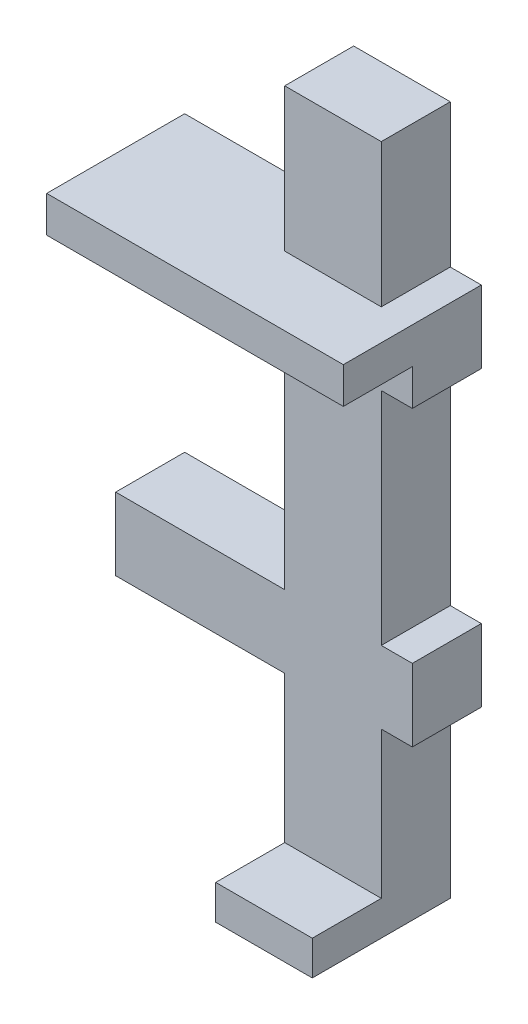
from build123d import *

# Parameters (mm, degrees)
SKETCH1_W               = 5.6
SKETCH1_H               = 40
BOSS_EXTRUDE1_DEPTH     = 4
SKETCH2_W               = 5.6
SKETCH2_H               = 2
BOSS_EXTRUDE2_DEPTH     = 4
SKETCH4_W               = 4
SKETCH4_H               = 4.2
BOSS_EXTRUDE3_DEPTH     = 1.8
MIRROR2_COPY_1_SKETCH_W = 4
MIRROR2_COPY_1_SKETCH_H = 4.2
MIRROR2_COPY_1_DEPTH    = 1.8
SKETCH8_W               = 4
SKETCH8_H               = 4.2
BOSS_EXTRUDE4_DEPTH     = 8
SKETCH9_W               = 17.2
SKETCH9_H               = 2.1
BOSS_EXTRUDE5_DEPTH     = 4


with BuildPart() as part:
    # Sketch1 → Boss-Extrude1 (new body)
    with BuildSketch(Plane.XY):
        Rectangle(SKETCH1_W, SKETCH1_H)
    extrude(amount=BOSS_EXTRUDE1_DEPTH)

    # Sketch2 → Boss-Extrude2 (add)
    with BuildSketch(Plane.XY.offset(4)):
        with Locations((0, -19)):
            Rectangle(SKETCH2_W, SKETCH2_H)
    extrude(amount=BOSS_EXTRUDE2_DEPTH)

    # Sketch4 → Boss-Extrude3 (add)
    with BuildSketch(Plane.ZY.offset(2.8)):
        with Locations((2, 9.6)):
            Rectangle(SKETCH4_W, SKETCH4_H)
    boss_extrude3 = extrude(amount=BOSS_EXTRUDE3_DEPTH)

    # Mirror1: Boss-Extrude3 across plane
    add(boss_extrude3.mirror(Plane.ZY))

    # Mirror2: Boss-Extrude3 across plane
    add(boss_extrude3.mirror(Plane(origin=(0, 1.1, 0), x_dir=(0, 0, 1), z_dir=(0, -1, 0))))

    # Mirror2 copy 1 sketch → Mirror2 copy 1 (add)
    with BuildSketch(Plane(origin=(2.8, 2.2, 0), x_dir=(0, 0, 1), z_dir=(1, 0, 0))):
        with Locations((2, 9.6)):
            Rectangle(MIRROR2_COPY_1_SKETCH_W, MIRROR2_COPY_1_SKETCH_H)
    extrude(amount=MIRROR2_COPY_1_DEPTH)

    # Sketch8 → Boss-Extrude4 (add)
    with BuildSketch(Plane.ZY.offset(4.6)):
        with Locations((2, 9.6)):
            Rectangle(SKETCH8_W, SKETCH8_H)
        with Locations((2, -7.4)):
            Rectangle(SKETCH8_W, SKETCH8_H)
    extrude(amount=BOSS_EXTRUDE4_DEPTH)

    # Sketch9 → Boss-Extrude5 (add)
    with BuildSketch(Plane.XY.offset(4)):
        with Locations((-4, 10.65)):
            Rectangle(SKETCH9_W, SKETCH9_H)
    extrude(amount=BOSS_EXTRUDE5_DEPTH)


solid = part.part
